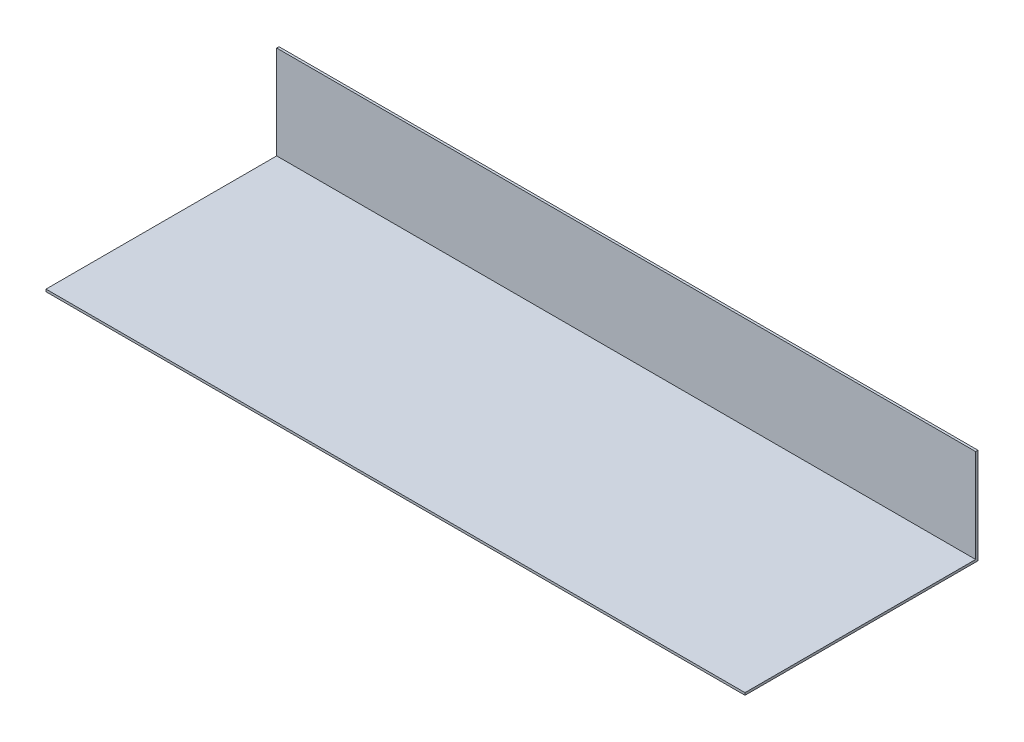
from build123d import *

# Parameters (mm, degrees)
SKETCH2_W           = 900
SKETCH2_H           = 300
BOSS_EXTRUDE1_DEPTH = 3
SKETCH3_W           = 900
SKETCH3_H           = 3
BOSS_EXTRUDE2_DEPTH = 120.3


with BuildPart() as part:
    # Sketch2 → Boss-Extrude1 (new body)
    with BuildSketch(Plane(origin=(0, 0, 0), x_dir=(1, 0, 0), z_dir=(0, 1, 0))):
        Rectangle(SKETCH2_W, SKETCH2_H)
    extrude(amount=BOSS_EXTRUDE1_DEPTH)

    # Sketch3 → Boss-Extrude2 (add)
    with BuildSketch(Plane(origin=(0, 3, 0), x_dir=(1, 0, 0), z_dir=(0, 1, 0))):
        with Locations((0, 148.5)):
            Rectangle(SKETCH3_W, SKETCH3_H)
    extrude(amount=BOSS_EXTRUDE2_DEPTH)


solid = part.part
